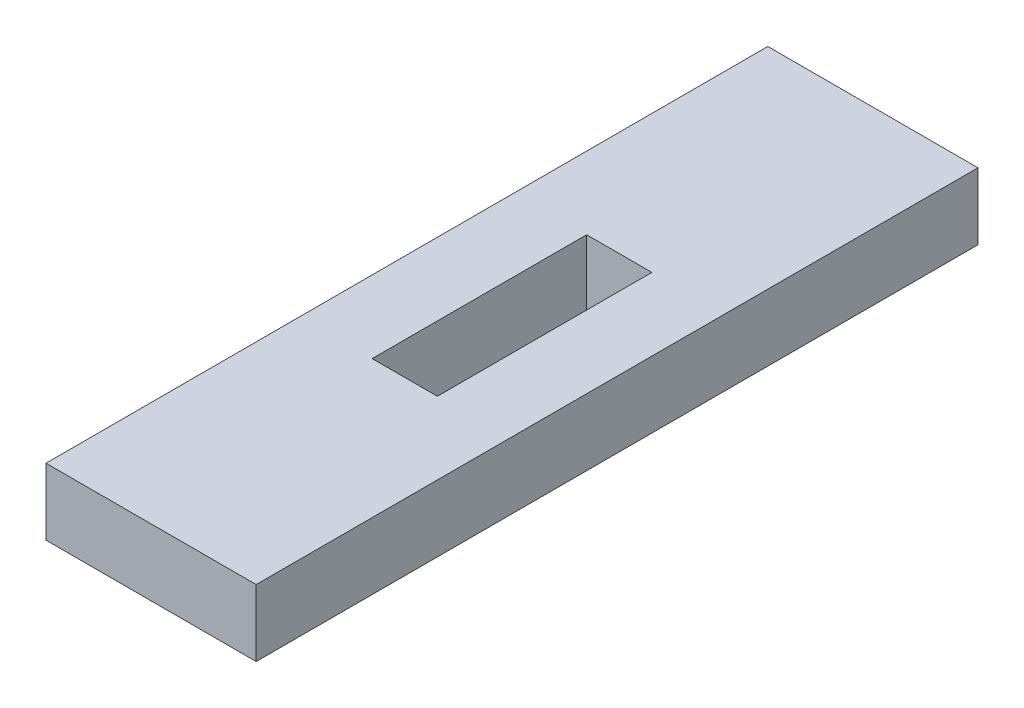
from build123d import *

# Parameters (mm, degrees)
SKETCH1_W           = 36.83
SKETCH1_H           = 126.492
SKETCH1_W_2         = 11.43
SKETCH1_H_2         = 37.592
BOSS_EXTRUDE1_DEPTH = 11.684


with BuildPart() as part:
    # Sketch1 → Boss-Extrude1 (new body)
    with BuildSketch(Plane(origin=(0, 0, 0), x_dir=(1, 0, 0), z_dir=(0, 1, 0))):
        Rectangle(SKETCH1_W, SKETCH1_H)
        Rectangle(SKETCH1_W_2, SKETCH1_H_2, mode=Mode.SUBTRACT)
    extrude(amount=BOSS_EXTRUDE1_DEPTH)


solid = part.part
